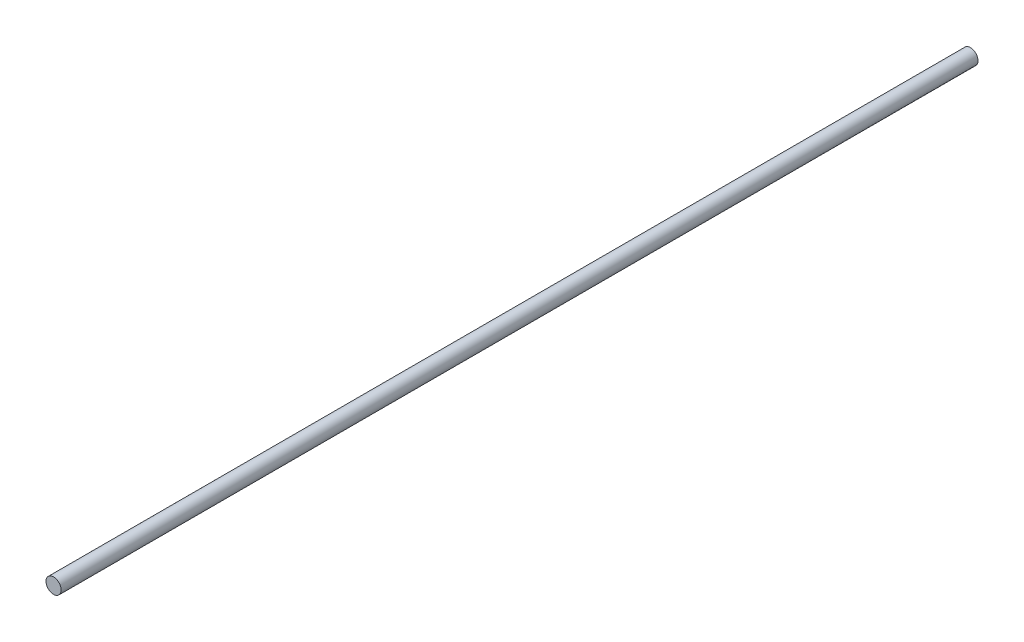
from build123d import *

# Parameters (mm, degrees)
SKETCH_1_R      = 4
EXTRUDE_1_DEPTH = 484


with BuildPart() as part:
    # 草图1 → 凸台-拉伸1 (new body)
    with BuildSketch(Plane.XY):
        with Locations((-9.714285714, 12.021428571)):
            Circle(SKETCH_1_R)
    extrude(amount=EXTRUDE_1_DEPTH)


solid = part.part
